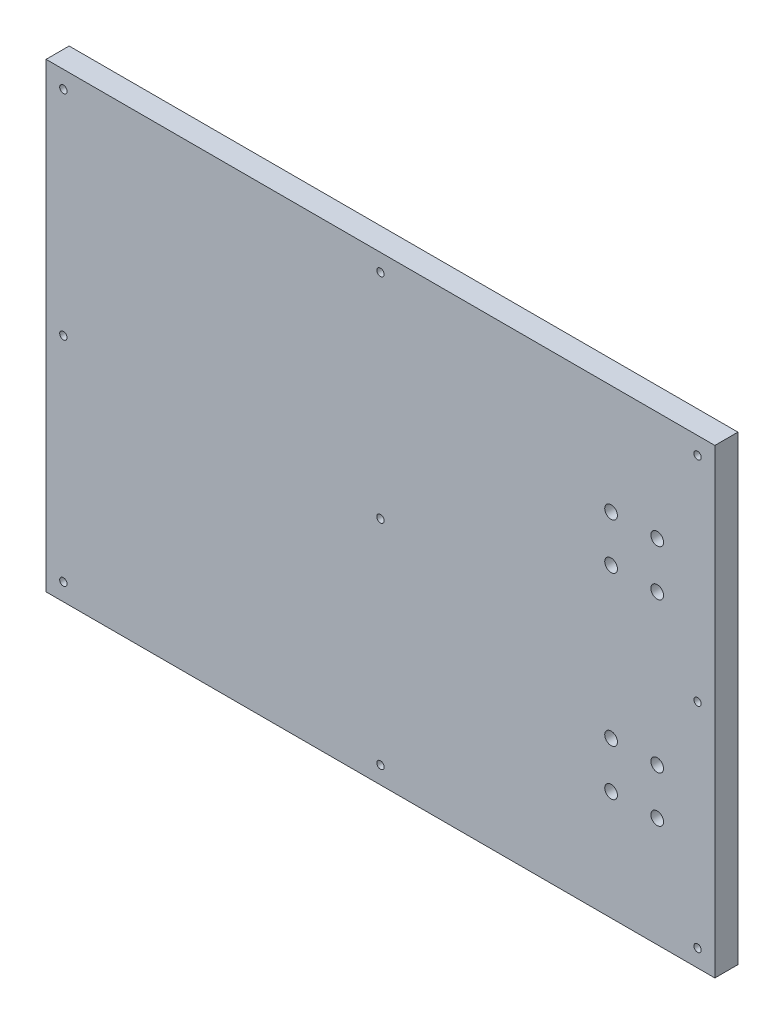
from build123d import *

# Parameters (mm, degrees)
MODEL_W         = 290
MODEL_H         = 200
MODEL_R         = 2.75
MODEL_R_2       = 1.6
EXTRUDE_1_DEPTH = 10


with BuildPart() as part:
    # Model → 凸台-拉伸1 (new body)
    with BuildSketch(Plane.XY):
        with Locations((642.697027816, 272.461256116)):
            Rectangle(MODEL_W, MODEL_H)
        with Locations((742.697027816, 219.961256116)):
            Circle(MODEL_R, mode=Mode.SUBTRACT)
        with Locations((762.697027816, 219.961256116)):
            Circle(MODEL_R, mode=Mode.SUBTRACT)
        with Locations((742.697027816, 239.961256116)):
            Circle(MODEL_R, mode=Mode.SUBTRACT)
        with Locations((762.697027816, 239.961256116)):
            Circle(MODEL_R, mode=Mode.SUBTRACT)
        with Locations((742.697027816, 324.961256116)):
            Circle(MODEL_R, mode=Mode.SUBTRACT)
        with Locations((762.697027816, 324.961256116)):
            Circle(MODEL_R, mode=Mode.SUBTRACT)
        with Locations((742.697027816, 304.961256116)):
            Circle(MODEL_R, mode=Mode.SUBTRACT)
        with Locations((762.697027816, 304.961256116)):
            Circle(MODEL_R, mode=Mode.SUBTRACT)
        with Locations((642.697027816, 364.961256116)):
            Circle(MODEL_R_2, mode=Mode.SUBTRACT)
        with Locations((642.697027816, 179.961256116)):
            Circle(MODEL_R_2, mode=Mode.SUBTRACT)
        with Locations((505.197027816, 272.461256116)):
            Circle(MODEL_R_2, mode=Mode.SUBTRACT)
        with Locations((780.197027816, 272.461256116)):
            Circle(MODEL_R_2, mode=Mode.SUBTRACT)
        with Locations((642.697027816, 272.461256116)):
            Circle(MODEL_R_2, mode=Mode.SUBTRACT)
        with Locations((780.197027816, 364.961256116)):
            Circle(MODEL_R_2, mode=Mode.SUBTRACT)
        with Locations((505.197027816, 364.961256116)):
            Circle(MODEL_R_2, mode=Mode.SUBTRACT)
        with Locations((780.197027816, 179.961256116)):
            Circle(MODEL_R_2, mode=Mode.SUBTRACT)
        with Locations((505.197027816, 179.961256116)):
            Circle(MODEL_R_2, mode=Mode.SUBTRACT)
    extrude(amount=EXTRUDE_1_DEPTH)


solid = part.part
